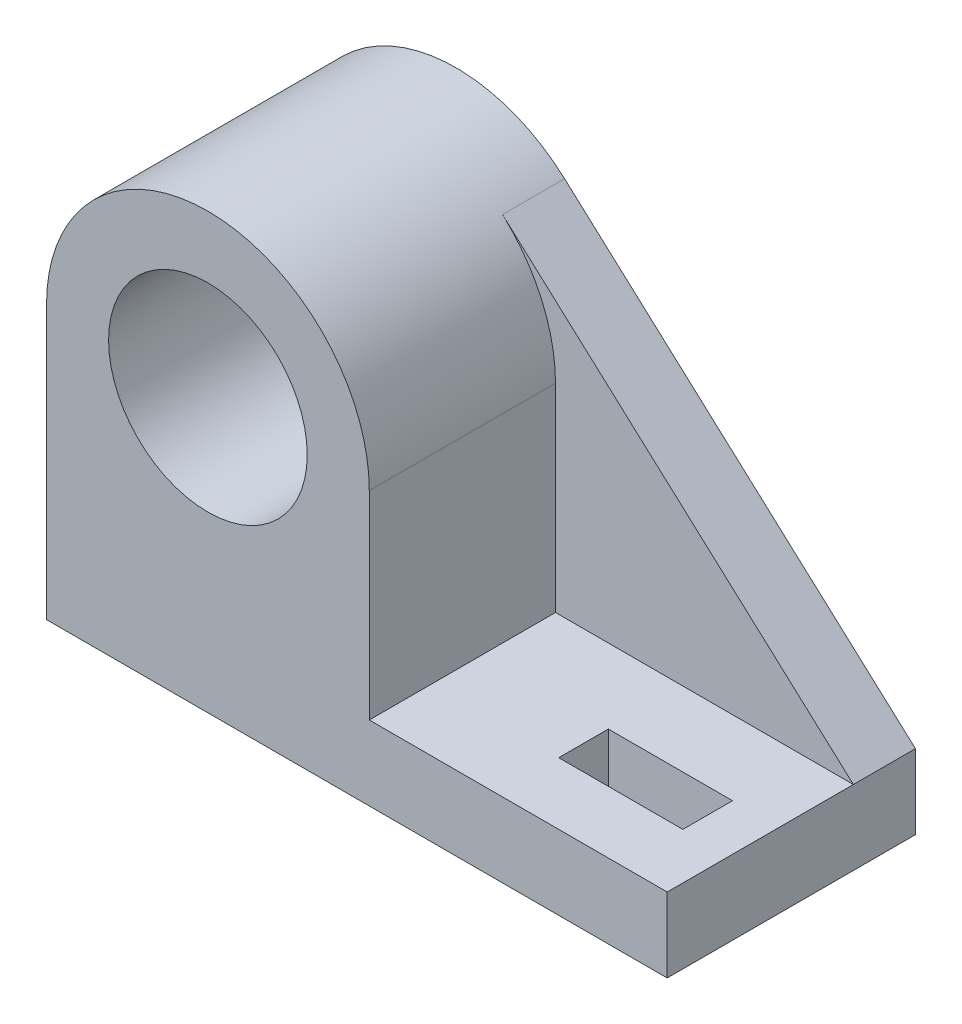
from build123d import *

# Parameters (mm, degrees)
SKETCH1_R           = 16
BOSS_EXTRUDE1_DEPTH = 40
RIB1_REACH          = 99.617
SKETCH5_WALL_W      = 273.54941501
SKETCH5_WALL_H      = 10
SKETCH8_W           = 20
SKETCH8_H           = 8
CUT_EXTRUDE2_DEPTH  = 40


with BuildPart() as part:
    # Sketch1 → Boss-Extrude1 (new body)
    with BuildSketch(Plane.XY):
        with BuildLine():
            Line((-44.962686567, 12), (-44.962686567, 44))
            ThreePointArc((-44.962686567, 44), (-18.962686567, 70), (7.037313433, 44))
            Line((7.037313433, 44), (7.037313433, 12))
            Line((7.037313433, 12), (55.037313433, 12))
            Line((55.037313433, 12), (55.037313433, 0))
            Line((55.037313433, 0), (-44.962686567, 0))
            Line((-44.962686567, 0), (-44.962686567, 12))
        make_face()
        with Locations((-18.962686567, 44)):
            Circle(SKETCH1_R, mode=Mode.SUBTRACT)
    extrude(amount=-BOSS_EXTRUDE1_DEPTH)

    # Sketch5 wall → Rib1 (add, up to next)
    with BuildSketch(Plane(origin=(26.769481976, 37.630640297, -40), x_dir=(-0.740818472674, 0.671705285483, 0), z_dir=(-0.671705285483, -0.740818472674, 0)), mode=Mode.PRIVATE) as rib1_sk1:
        with Locations((0, -5)):
            Rectangle(SKETCH5_WALL_W, SKETCH5_WALL_H)
    rib1_tool1 = extrude(rib1_sk1.sketch, amount=RIB1_REACH, mode=Mode.PRIVATE) - part.part
    add(rib1_tool1.solids().sort_by_distance((26.769481976, 37.630640297, -40))[0])

    # Sketch8 → Cut-Extrude2 (cut)
    with BuildSketch(Plane(origin=(0, 12, 0), x_dir=(1, 0, 0), z_dir=(0, 1, 0))):
        with Locations((37.559585663, 14)):
            Rectangle(SKETCH8_W, SKETCH8_H)
    extrude(amount=-CUT_EXTRUDE2_DEPTH, mode=Mode.SUBTRACT)


solid = part.part
